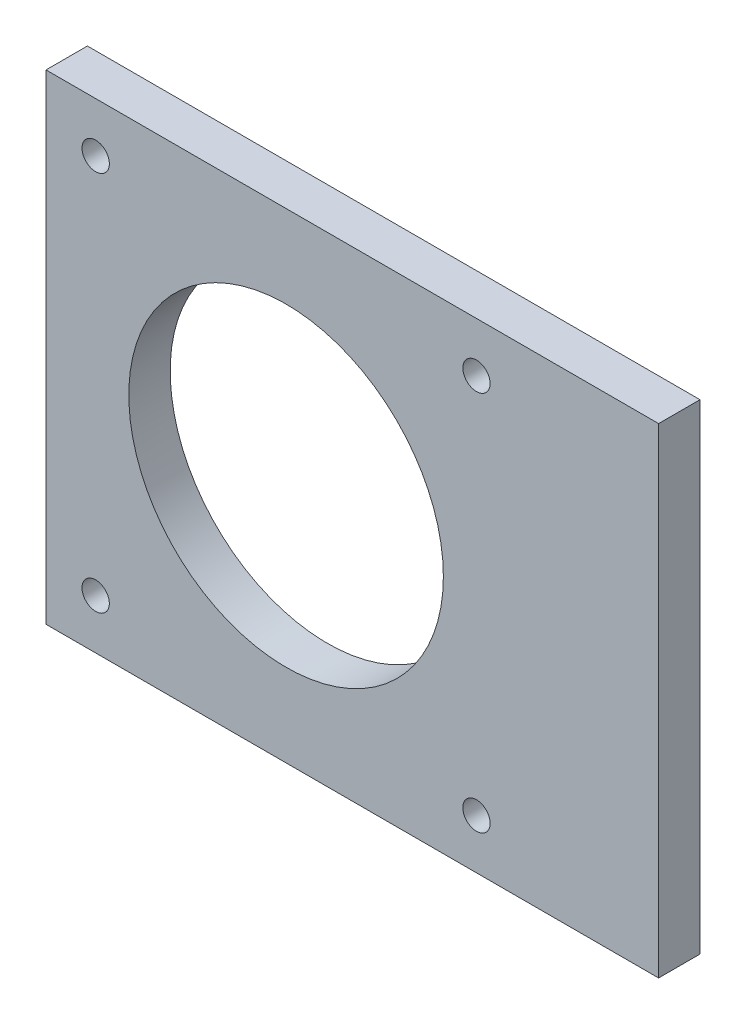
from build123d import *

# Parameters (mm, degrees)
EXTRUDE_1_DEPTH     = 5
HOLE_WIZARD_M4_1_D  = 3.3
SKETCH_5_R          = 19
CUT_EXTRUDE_1_DEPTH = 54.768020235


with BuildPart() as part:
    # 草图1 → 凸台-拉伸1 (new body)
    with BuildSketch(Plane.XY):
        Polygon((29, 29), (45, 29), (45, -29), (29, -29), (-29, -29), (-29, 29), align=None)
    extrude(amount=EXTRUDE_1_DEPTH)

    # M4 螺纹孔的螺纹孔钻头1 (through all)
    with Locations(Plane(origin=(-23, 23, 5), x_dir=(1, 0, 0), z_dir=(0, 0, 1))):
        with Locations((0, 0), (46, 0)):
            hole_wizard_m4_1 = Hole(HOLE_WIZARD_M4_1_D / 2)

    # 镜向1: M4 螺纹孔的螺纹孔钻头1 across plane
    add(hole_wizard_m4_1.mirror(Plane.ZX), mode=Mode.SUBTRACT)

    # 草图5 → 切除-拉伸1 (cut, through all)
    with BuildSketch(Plane.XY.offset(5)):
        Circle(SKETCH_5_R)
    extrude(amount=-CUT_EXTRUDE_1_DEPTH, mode=Mode.SUBTRACT)


solid = part.part
